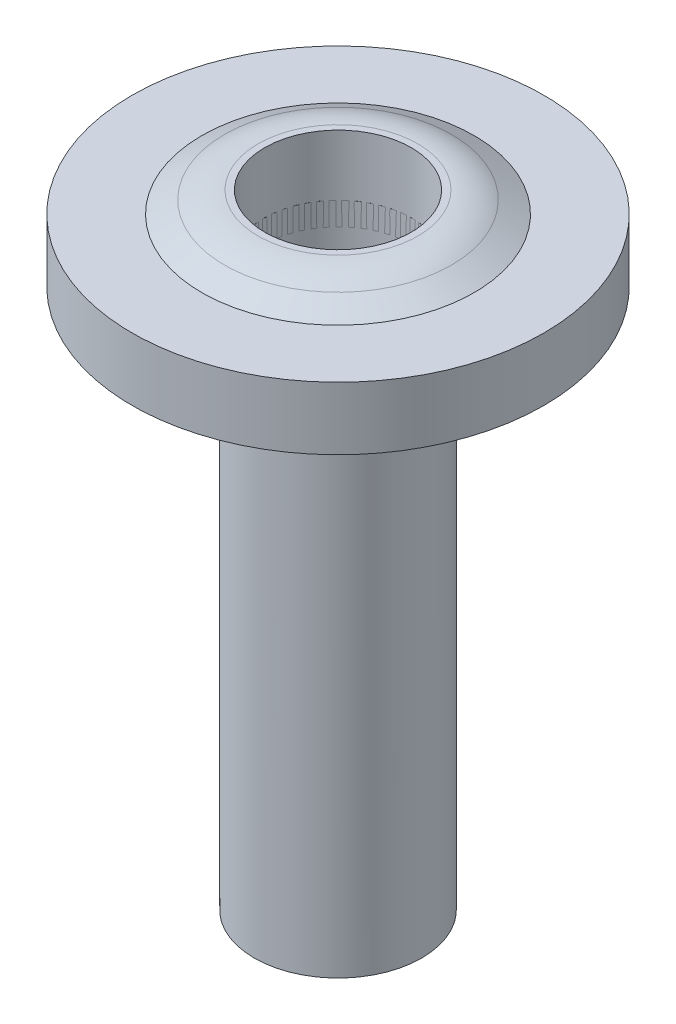
from build123d import *

# Parameters (mm, degrees)
CROQUIS3_W              = 28.5
CROQUIS3_H              = 7.3
REDONDEO1_R             = 2
CROQUIS7_R              = 10.5
CORTAR_EXTRUIR2_DEPTH   = 93.002717351
CROQUIS8_R              = 12
CROQUIS8_R_2            = 10.5
SALIENTE_EXTRUIR1_DEPTH = 7.3


with BuildPart() as part:
    # Croquis1 → Revolución1 (revolve)
    with BuildSketch(Plane.XY, mode=Mode.PRIVATE) as revoluci_n1_sk:
        Polygon((12, 0), (12, 69.3), (25, 69.3), (25, 73.3), (0, 73.3), (0, 0), align=None)
    revolve(revoluci_n1_sk.sketch.rotate(Axis((0, 73.3, 0), (0, -1, 0)), 180), axis=Axis((0, 73.3, 0), (0, -1, 0)))


with BuildPart() as body_2:
    # Croquis3 → Revolución2 (revolve)
    with BuildSketch(Plane.XY, mode=Mode.PRIVATE) as revoluci_n2_sk:
        with Locations((14.25, 73.65)):
            Rectangle(CROQUIS3_W, CROQUIS3_H)
    revolve(revoluci_n2_sk.sketch.rotate(Axis((0, 70, 0), (0, 1, 0)), 90), axis=Axis((0, 70, 0), (0, 1, 0)))

    # Redondeo1
    redondeo1_edges = [body_2.edges().sort_by_distance(p)[0] for p in [
        (0, 77.3, 28.5),
    ]]
    fillet(redondeo1_edges, radius=REDONDEO1_R)

    # Croquis6 → Revolución4 (revolve)
    with BuildSketch(Plane.XY, mode=Mode.PRIVATE) as revoluci_n4_sk:
        with BuildLine():
            Line((0, 70), (29.5, 70))
            Line((29.5, 70), (29.5, 79))
            Line((29.5, 79), (19.5, 79))
            Line((19.5, 79), (16.238581163, 80.778955729))
            ThreePointArc((16.238581163, 80.778955729), (13.92093447, 81.689931818), (11.450059856, 82))
            Line((11.450059856, 82), (0, 82))
            Line((0, 82), (0, 70))
        make_face()
    revolve(revoluci_n4_sk.sketch.rotate(Axis((0, 82, 0), (0, -1, 0)), 180), axis=Axis((0, 82, 0), (0, -1, 0)))


with BuildPart() as cortar_extruir2_tool:
    # Croquis7 → Cortar-Extruir2 (new, through all)
    with BuildSketch(Plane(origin=(0, 82, 0), x_dir=(1, 0, 0), z_dir=(0, 1, 0))):
        with Locations(Location((0, 0, 0), (0, 0, 180))):
            Circle(CROQUIS7_R)
    extrude(amount=-CORTAR_EXTRUIR2_DEPTH)


with BuildPart() as part_1:
    add(part.part)

    # Cortar-Extruir2: cut by cortar_extruir2_tool
    add(cortar_extruir2_tool.part, mode=Mode.SUBTRACT)

    # Croquis8 → Saliente-Extruir1 (add)
    with BuildSketch(Plane.XZ):
        with Locations(Location((0, 0, 0), (0, 0, 180))):
            Circle(CROQUIS8_R)
        with Locations(Location((0, 0, 0), (0, 0, 180))):
            Circle(CROQUIS8_R_2, mode=Mode.SUBTRACT)
    extrude(amount=SALIENTE_EXTRUIR1_DEPTH)


with BuildPart() as body_2_1:
    add(body_2.part)

    # Cortar-Extruir2: cut by cortar_extruir2_tool
    add(cortar_extruir2_tool.part, mode=Mode.SUBTRACT)


solid = Compound([part_1.part, body_2_1.part])
